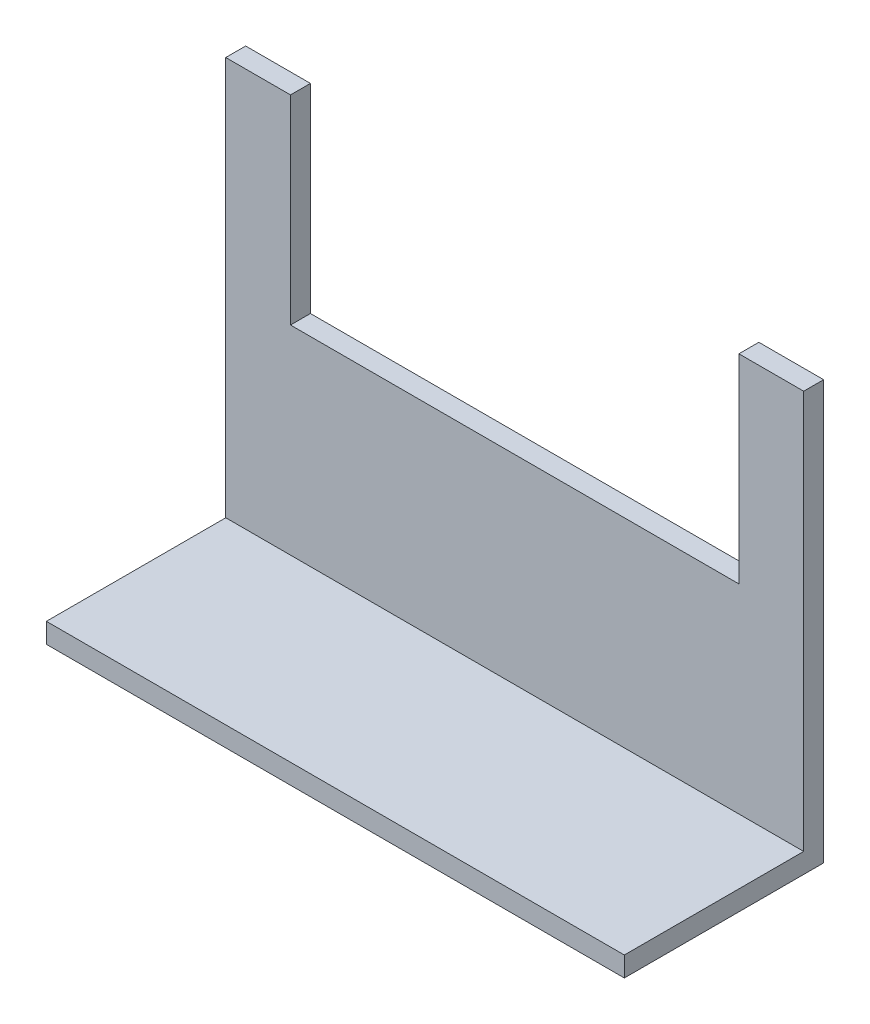
from build123d import *

# Parameters (mm, degrees)
SKETCH1_W           = 58
SKETCH1_H           = 20
BOSS_EXTRUDE1_DEPTH = 2
SKETCH2_W           = 58
SKETCH2_H           = 2
BOSS_EXTRUDE2_DEPTH = 40
SKETCH3_W           = 45
SKETCH3_H           = 20
CUT_EXTRUDE1_DEPTH  = 60


with BuildPart() as part:
    # Sketch1 → Boss-Extrude1 (new body)
    with BuildSketch(Plane(origin=(0, 0, 0), x_dir=(1, 0, 0), z_dir=(0, 1, 0))):
        Rectangle(SKETCH1_W, SKETCH1_H)
    extrude(amount=BOSS_EXTRUDE1_DEPTH)

    # Sketch2 → Boss-Extrude2 (add)
    with BuildSketch(Plane(origin=(0, 2, 0), x_dir=(1, 0, 0), z_dir=(0, 1, 0))):
        with Locations((0, 9)):
            Rectangle(SKETCH2_W, SKETCH2_H)
    extrude(amount=BOSS_EXTRUDE2_DEPTH)

    # Sketch3 → Cut-Extrude1 (cut)
    with BuildSketch(Plane.XY.offset(-8)):
        with Locations((0, 32)):
            Rectangle(SKETCH3_W, SKETCH3_H)
    extrude(amount=-CUT_EXTRUDE1_DEPTH, mode=Mode.SUBTRACT)


solid = part.part
